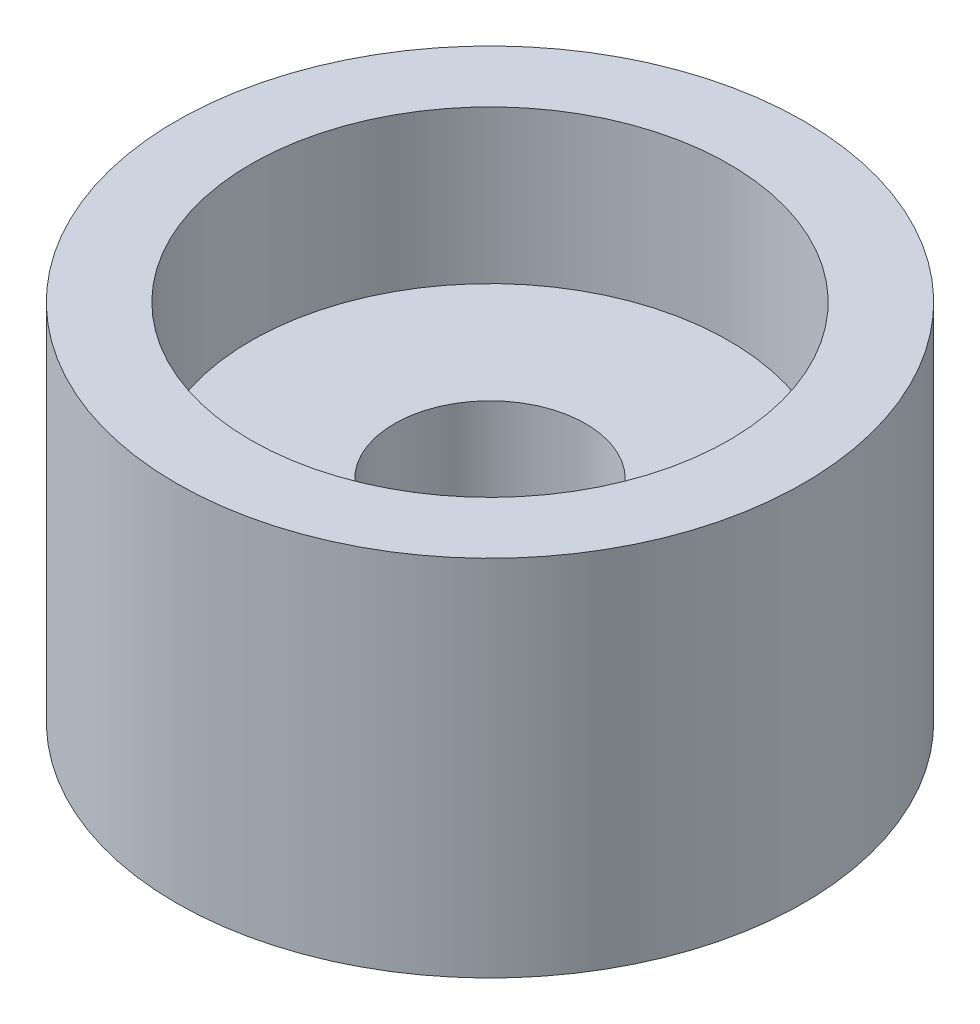
from build123d import *

# Parameters (mm, degrees)
SKETCH1_R           = 8.2
BOSS_EXTRUDE1_DEPTH = 9.5
SKETCH2_R           = 6.25
CUT_EXTRUDE1_DEPTH  = 4
SKETCH3_R           = 2.5
CUT_EXTRUDE2_DEPTH  = 13.83471854


with BuildPart() as part:
    # Sketch1 → Boss-Extrude1 (new body)
    with BuildSketch(Plane(origin=(0, 0, 0), x_dir=(1, 0, 0), z_dir=(0, 1, 0))):
        with Locations(Location((0, 0, 0), (0, 0, 270))):
            Circle(SKETCH1_R)
    extrude(amount=BOSS_EXTRUDE1_DEPTH)

    # Sketch2 → Cut-Extrude1 (cut)
    with BuildSketch(Plane(origin=(0, 9.5, 0), x_dir=(1, 0, 0), z_dir=(0, 1, 0))):
        with Locations(Location((0, 0, 0), (0, 0, 270))):
            Circle(SKETCH2_R)
    extrude(amount=-CUT_EXTRUDE1_DEPTH, mode=Mode.SUBTRACT)

    # Sketch3 → Cut-Extrude2 (cut, through all)
    with BuildSketch(Plane(origin=(0, 5.5, 0), x_dir=(1, 0, 0), z_dir=(0, 1, 0))):
        with Locations(Location((0, 0, 0), (0, 0, 270))):
            Circle(SKETCH3_R)
    extrude(amount=-CUT_EXTRUDE2_DEPTH, mode=Mode.SUBTRACT)


solid = part.part
